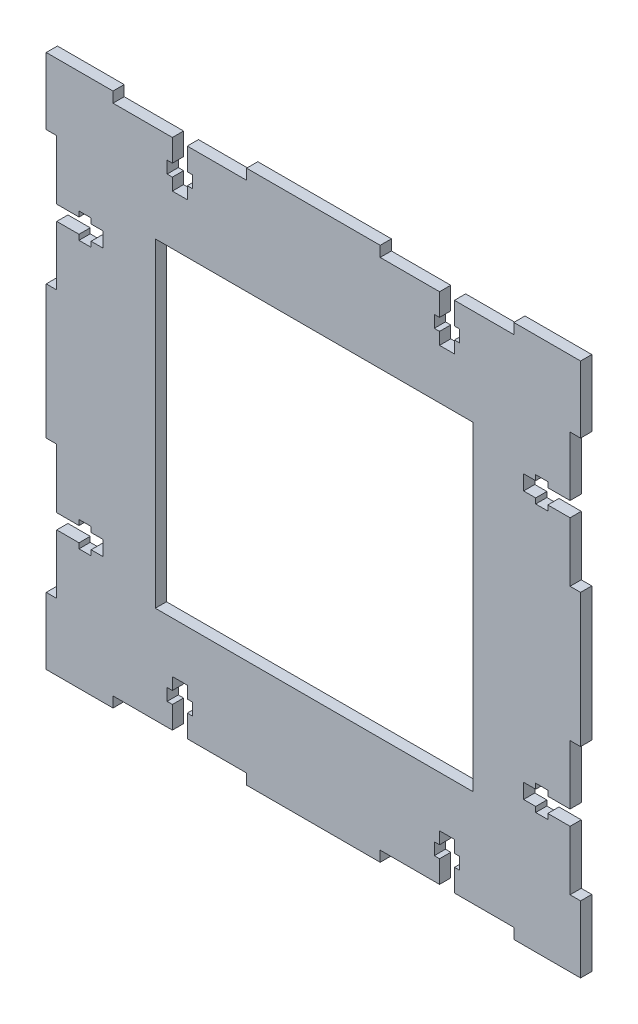
from build123d import *

# Parameters (mm, degrees)
SKETCH1_W           = 89.973098965
SKETCH1_H           = 90.646237782
BOSS_EXTRUDE1_DEPTH = 3.175


with BuildPart() as part:
    # Sketch1 → Boss-Extrude1 (new body)
    with BuildSketch(Plane.XY):
        Polygon((0, 154.39750188), (0, 135.470394989), (2.980646754, 135.470394989), (2.980646754, 118.65457955), (9.289682385, 118.65457955), (9.289682385, 120.144902927), (12.717426152, 120.144902927), (12.717426152, 118.65457955), (16.14516992, 118.65457955), (16.14516992, 114.431996648), (12.717426152, 114.431996648), (12.717426152, 112.94167327), (9.289682385, 112.94167327), (9.289682385, 114.431996648), (2.980646754, 114.431996648), (2.980646754, 97.616181208), (0, 97.616181208), (0, 59.761967427), (2.980646754, 59.761967427), (2.980646754, 42.946151987), (9.289682385, 42.946151987), (9.289682385, 44.436475364), (12.717426152, 44.436475364), (12.717426152, 42.946151987), (16.14516992, 42.946151987), (16.14516992, 38.723569085), (12.717426152, 38.723569085), (12.717426152, 37.233245708), (9.289682385, 37.233245708), (9.289682385, 38.723569085), (2.980646754, 38.723569085), (2.980646754, 21.907753645), (0, 21.907753645), (0, 2.980646754), (18.927106891, 2.980646754), (18.927106891, 5.961293509), (35.74292233, 5.961293509), (35.74292233, 12.270329139), (34.252598953, 12.270329139), (34.252598953, 15.698072907), (35.74292233, 15.698072907), (35.74292233, 19.125816674), (39.965505232, 19.125816674), (39.965505232, 15.698072907), (41.45582861, 15.698072907), (41.45582861, 12.270329139), (39.965505232, 12.270329139), (39.965505232, 5.961293509), (56.781320672, 5.961293509), (56.781320672, 2.980646754), (94.635534454, 2.980646754), (94.635534454, 5.961293509), (111.451349893, 5.961293509), (111.451349893, 12.270329139), (109.961026516, 12.270329139), (109.961026516, 15.698072907), (111.451349893, 15.698072907), (111.451349893, 19.125816674), (115.673932795, 19.125816674), (115.673932795, 15.698072907), (117.164256172, 15.698072907), (117.164256172, 12.270329139), (115.673932795, 12.270329139), (115.673932795, 5.961293509), (132.489748235, 5.961293509), (132.489748235, 2.980646754), (151.416855126, 2.980646754), (151.416855126, 21.907753645), (148.436208371, 21.907753645), (148.436208371, 38.723569085), (142.127172741, 38.723569085), (142.127172741, 37.233245708), (138.699428973, 37.233245708), (138.699428973, 38.723569085), (135.271685206, 38.723569085), (135.271685206, 42.946151987), (138.699428973, 42.946151987), (138.699428973, 44.436475364), (142.127172741, 44.436475364), (142.127172741, 42.946151987), (148.436208371, 42.946151987), (148.436208371, 59.761967427), (151.416855126, 59.761967427), (151.416855126, 97.616181208), (148.436208371, 97.616181208), (148.436208371, 114.431996648), (142.127172741, 114.431996648), (142.127172741, 112.94167327), (138.699428973, 112.94167327), (138.699428973, 114.431996648), (135.271685206, 114.431996648), (135.271685206, 118.65457955), (138.699428973, 118.65457955), (138.699428973, 120.144902927), (142.127172741, 120.144902927), (142.127172741, 118.65457955), (148.436208371, 118.65457955), (148.436208371, 135.470394989), (151.416855126, 135.470394989), (151.416855126, 154.39750188), (132.489748235, 154.39750188), (132.489748235, 151.416855126), (115.673932795, 151.416855126), (115.673932795, 145.107819495), (117.164256172, 145.107819495), (117.164256172, 141.680075728), (115.673932795, 141.680075728), (115.673932795, 138.25233196), (111.451349893, 138.25233196), (111.451349893, 141.680075728), (109.961026516, 141.680075728), (109.961026516, 145.107819495), (111.451349893, 145.107819495), (111.451349893, 151.416855126), (94.635534454, 151.416855126), (94.635534454, 154.39750188), (56.781320672, 154.39750188), (56.781320672, 151.416855126), (39.965505232, 151.416855126), (39.965505232, 145.107819495), (41.45582861, 145.107819495), (41.45582861, 141.680075728), (39.965505232, 141.680075728), (39.965505232, 138.25233196), (35.74292233, 138.25233196), (35.74292233, 141.680075728), (34.252598953, 141.680075728), (34.252598953, 145.107819495), (35.74292233, 145.107819495), (35.74292233, 151.416855126), (18.927106891, 151.416855126), (18.927106891, 154.39750188), align=None)
        with Locations((75.89557754, 78.791987571)):
            Rectangle(SKETCH1_W, SKETCH1_H, mode=Mode.SUBTRACT)
    extrude(amount=BOSS_EXTRUDE1_DEPTH)


solid = part.part
